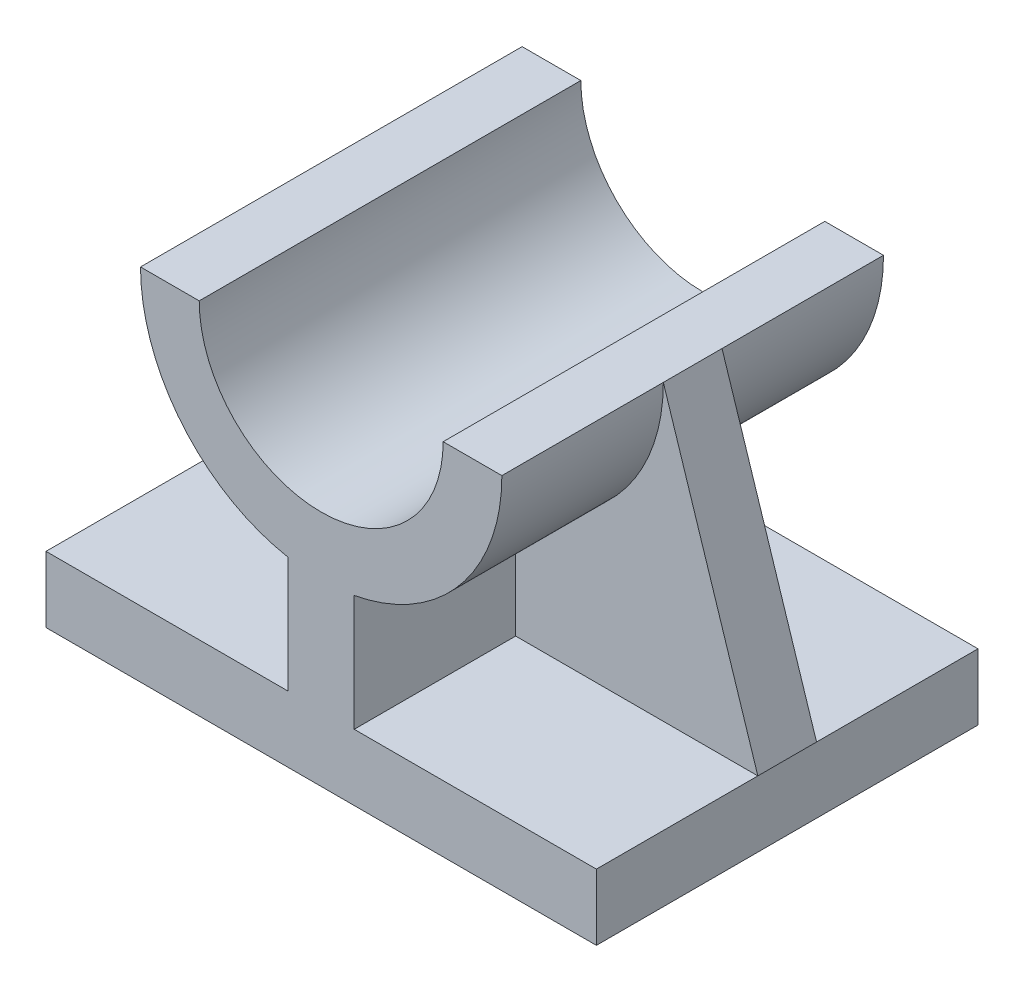
from build123d import *

# Parameters (mm, degrees)
BOSS_EXTRUDE1_DEPTH = 52
BOSS_EXTRUDE2_DEPTH = 4


with BuildPart() as part:
    # Sketch1 → Boss-Extrude1 (new body)
    with BuildSketch(Plane.XY):
        with BuildLine():
            Line((-37.913907285, 9), (-37.913907285, 0))
            Line((-37.913907285, 0), (37.086092715, 0))
            Line((37.086092715, 0), (37.086092715, 9))
            Line((37.086092715, 9), (4.086092715, 9))
            Line((4.086092715, 9), (4.086092715, 24.793471725))
            ThreePointArc((4.086092715, 24.793471725), (18.520210619, 33.261347251), (24.207343925, 49))
            Line((24.207343925, 49), (16.207343925, 49))
            ThreePointArc((16.207343925, 49), (-0.413907285, 32.37874879), (-17.035158495, 49))
            Line((-17.035158495, 49), (-25.035158495, 49))
            ThreePointArc((-25.035158495, 49), (-19.348025189, 33.261347251), (-4.913907285, 24.793471725))
            Line((-4.913907285, 24.793471725), (-4.913907285, 9))
            Line((-4.913907285, 9), (-37.913907285, 9))
        make_face()
    extrude(amount=-BOSS_EXTRUDE1_DEPTH)


with BuildPart() as part_1:
    # Body-Move/Copy1: moved
    add(part.part.moved(Location((0, 0, 26))))

    # Sketch3 → Boss-Extrude2 (add, symmetric)
    with BuildSketch(Plane.XY):
        with BuildLine():
            Line((24.207343925, 49), (37.086092715, 9))
            Line((37.086092715, 9), (4.086092715, 9))
            Line((4.086092715, 9), (4.086092715, 24.793471725))
            ThreePointArc((4.086092715, 24.793471725), (18.520210619, 33.261347251), (24.207343925, 49))
        make_face()
        with BuildLine():
            Line((-25.035158495, 49), (-37.913907285, 9))
            Line((-37.913907285, 9), (-4.913907285, 9))
            Line((-4.913907285, 9), (-4.913907285, 24.793471725))
            ThreePointArc((-4.913907285, 24.793471725), (-19.348025189, 33.261347251), (-25.035158495, 49))
        make_face()
    extrude(amount=BOSS_EXTRUDE2_DEPTH, both=True)


solid = part_1.part
